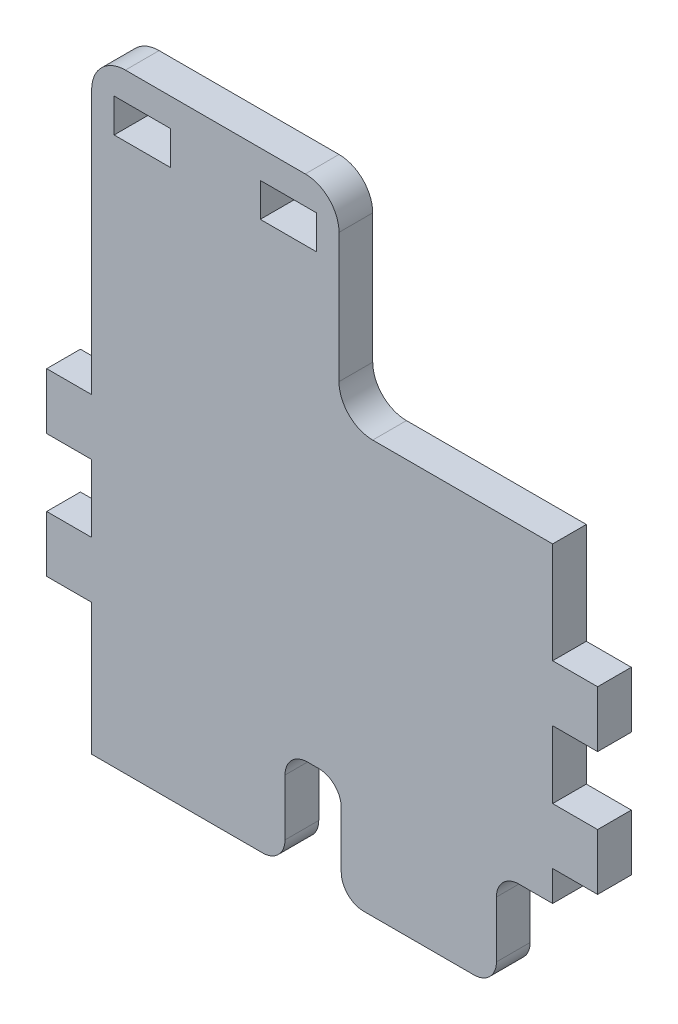
from build123d import *

# Parameters (mm, degrees)
SKETCH_1_W          = 41
SKETCH_1_H          = 30
EXTRUDE_1_DEPTH     = 3
SKETCH_2_W          = 4
SKETCH_2_H          = 5
EXTRUDE_2_DEPTH     = 3
SKETCH_3_W          = 22
SKETCH_3_H          = 17.5
EXTRUDE_3_DEPTH     = 3
SKETCH_4_W          = 5
SKETCH_4_H          = 3
CUT_EXTRUDE_1_DEPTH = 10
SKETCH_5_W          = 41
SKETCH_5_H          = 6.7
EXTRUDE_4_DEPTH     = 3
SKETCH_6_W          = 5
SKETCH_6_H          = 9
CUT_EXTRUDE_2_DEPTH = 10
FILLET_1_R          = 3
FILLET_2_R          = 2


with BuildPart() as part:
    # 草图1 → 凸台-拉伸1 (new body)
    with BuildSketch(Plane.XY):
        Rectangle(SKETCH_1_W, SKETCH_1_H)
    extrude(amount=EXTRUDE_1_DEPTH)

    # 草图2 → 凸台-拉伸2 (add)
    with BuildSketch(Plane.XY.offset(3)):
        with Locations((22.5, -7.5)):
            Rectangle(SKETCH_2_W, SKETCH_2_H)
        with Locations((22.5, 3.5)):
            Rectangle(SKETCH_2_W, SKETCH_2_H)
        with Locations((-22.5, -7.5)):
            Rectangle(SKETCH_2_W, SKETCH_2_H)
        with Locations((-22.5, 3.5)):
            Rectangle(SKETCH_2_W, SKETCH_2_H)
    extrude(amount=-EXTRUDE_2_DEPTH)

    # 草图3 → 凸台-拉伸3 (add)
    with BuildSketch(Plane(origin=(0, 0, 0), x_dir=(-1, 0, 0), z_dir=(0, 0, -1))):
        with Locations((9.5, 23.75)):
            Rectangle(SKETCH_3_W, SKETCH_3_H)
    extrude(amount=-EXTRUDE_3_DEPTH)

    # 草图4 → 切除-拉伸1 (cut)
    with BuildSketch(Plane(origin=(0, 0, 0), x_dir=(-1, 0, 0), z_dir=(0, 0, -1))):
        with Locations((3, 28.5)):
            Rectangle(SKETCH_4_W, SKETCH_4_H)
        with Locations((16, 28.5)):
            Rectangle(SKETCH_4_W, SKETCH_4_H)
    extrude(amount=-CUT_EXTRUDE_1_DEPTH, mode=Mode.SUBTRACT)

    # 草图5 → 凸台-拉伸4 (add)
    with BuildSketch(Plane(origin=(0, 0, 0), x_dir=(-1, 0, 0), z_dir=(0, 0, -1))):
        with Locations((0, -18.35)):
            Rectangle(SKETCH_5_W, SKETCH_5_H)
    extrude(amount=-EXTRUDE_4_DEPTH)

    # 草图6 → 切除-拉伸2 (cut)
    with BuildSketch(Plane(origin=(0, 0, 0), x_dir=(-1, 0, 0), z_dir=(0, 0, -1))):
        with Locations((0.8, -17.2)):
            Rectangle(SKETCH_6_W, SKETCH_6_H)
        with Locations((-18, -17.2)):
            Rectangle(SKETCH_6_W, SKETCH_6_H)
    extrude(amount=-CUT_EXTRUDE_2_DEPTH, mode=Mode.SUBTRACT)

    # 圆角1
    fillet_1_edges = [part.edges().sort_by_distance(p)[0] for p in [
        (-20.5, 32.5, 1.5),
        (1.5, 15, 1.5),
        (1.5, 32.5, 1.5),
    ]]
    fillet(fillet_1_edges, radius=FILLET_1_R)

    # 圆角2
    fillet_2_edges = [part.edges().sort_by_distance(p)[0] for p in [
        (1.7, -21.7, 1.5),
        (-3.3, -21.7, 1.5),
        (15.5, -21.7, 1.5),
        (15.5, -12.7, 1.5),
        (1.7, -12.7, 1.5),
        (-3.3, -12.7, 1.5),
    ]]
    fillet(fillet_2_edges, radius=FILLET_2_R)


solid = part.part
